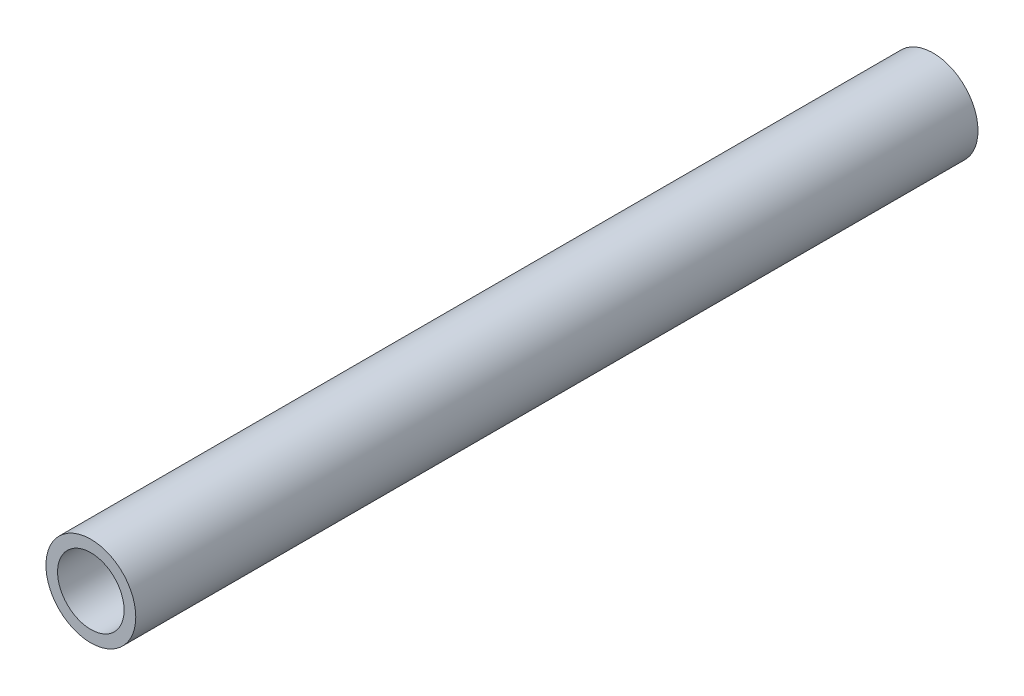
from build123d import *

# Parameters (mm, degrees)
SKETCH1_R           = 10.668
SKETCH1_R_2         = 7.8994
EXTRUDE_THIN1_DEPTH = 100


with BuildPart() as part:
    # Sketch1 → Extrude-Thin1 (new, symmetric)
    with BuildSketch(Plane.XY):
        Circle(SKETCH1_R)
        Circle(SKETCH1_R_2, mode=Mode.SUBTRACT)
    extrude(amount=EXTRUDE_THIN1_DEPTH, both=True)


solid = part.part
